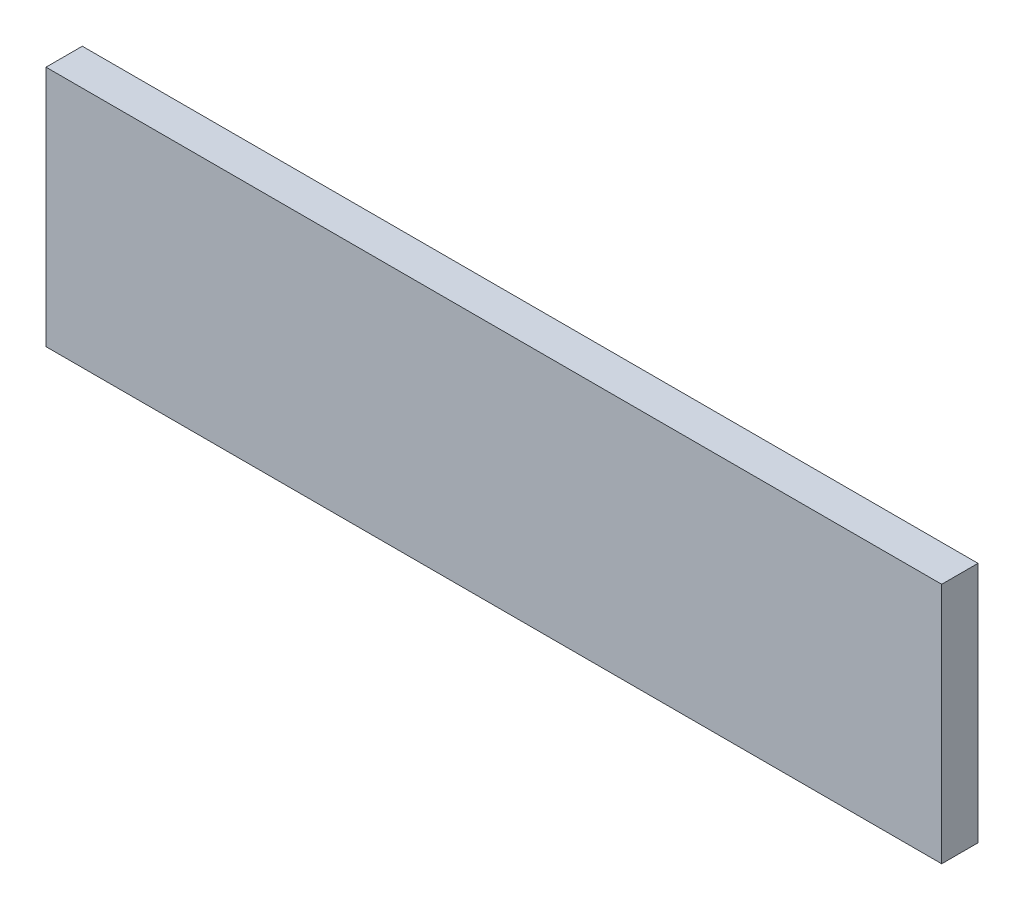
from build123d import *

# Parameters (mm, degrees)
SKETCH2_W           = 74
SKETCH2_H           = 20
BOSS_EXTRUDE1_DEPTH = 3


with BuildPart() as part:
    # Sketch2 → Boss-Extrude1 (new body)
    with BuildSketch(Plane.XY):
        Rectangle(SKETCH2_W, SKETCH2_H)
    extrude(amount=BOSS_EXTRUDE1_DEPTH)


solid = part.part
